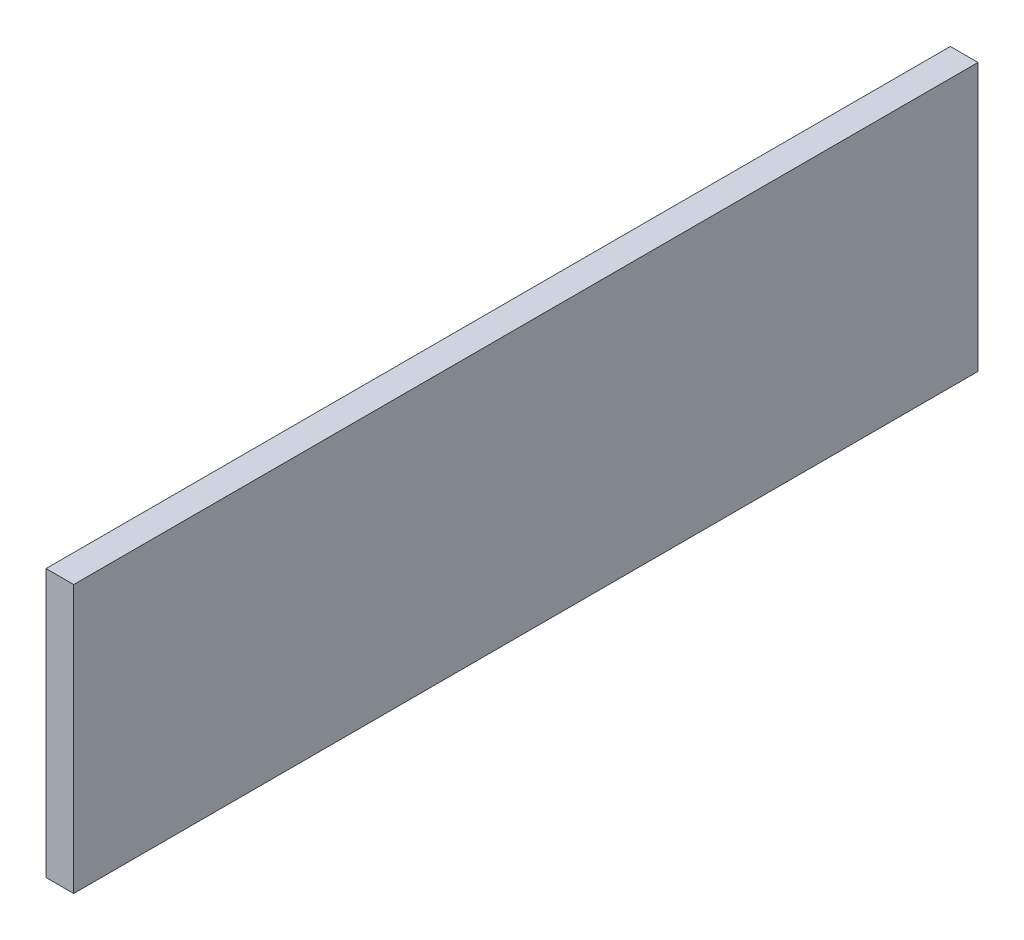
from build123d import *

# Parameters (mm, degrees)
SKETCH1_W           = 622.3
SKETCH1_H           = 184.15
BOSS_EXTRUDE1_DEPTH = 19.05


with BuildPart() as part:
    # Sketch1 → Boss-Extrude1 (new body)
    with BuildSketch(Plane(origin=(0, 0, 0), x_dir=(0, 0, -1), z_dir=(1, 0, 0))):
        with Locations((311.15, 92.075)):
            Rectangle(SKETCH1_W, SKETCH1_H)
    extrude(amount=BOSS_EXTRUDE1_DEPTH)


solid = part.part
